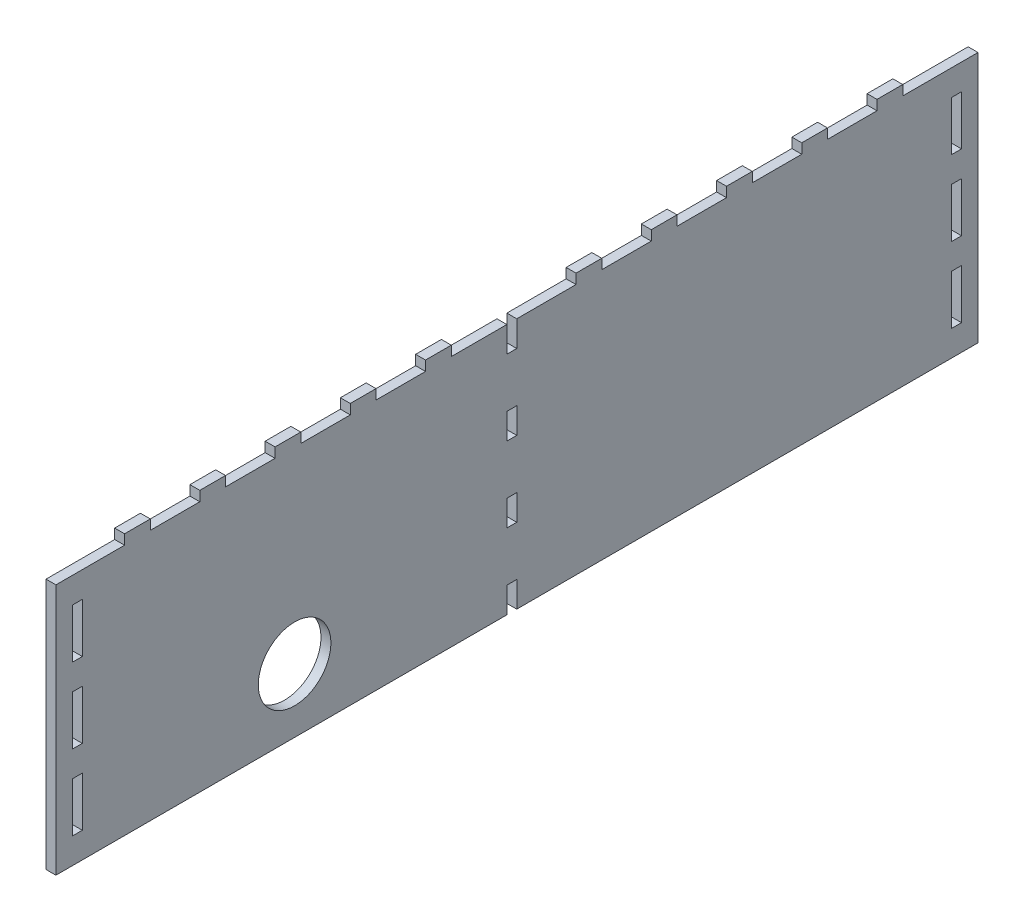
from build123d import *

# Parameters (mm, degrees)
SKETCH1_W               = 279.4
SKETCH1_H               = 76.2
BOSS_EXTRUDE1_DEPTH     = 3
SKETCH3_W               = 3
SKETCH3_H               = 15
CUT_EXTRUDE1_DEPTH      = 145.833352512
LPATTERN1_COUNT         = 3
LPATTERN1_PITCH         = 22.8
MIRROR1_COPY_1_SKETCH_W = 3
MIRROR1_COPY_1_SKETCH_H = 15
MIRROR1_COPY_1_DEPTH    = 145.833352512
MIRROR1_COPY_2_SKETCH_W = 3
MIRROR1_COPY_2_SKETCH_H = 15
MIRROR1_COPY_2_DEPTH    = 145.833352512
SKETCH6_W               = 3
SKETCH6_H               = 7.8
CUT_EXTRUDE2_DEPTH      = 145.833352512
LPATTERN2_COUNT         = 4
LPATTERN2_PITCH         = 22.8
SKETCH8_W               = 3
SKETCH8_H               = 7.8
BOSS_EXTRUDE2_DEPTH     = 3
LPATTERN4_COUNT         = 11
LPATTERN4_PITCH         = 22.8
SKETCH9_R               = 11
CUT_EXTRUDE3_DEPTH      = 146.651295909


with BuildPart() as part:
    # Sketch1 → Boss-Extrude1 (new body)
    with BuildSketch(Plane(origin=(0, 0, 0), x_dir=(0, 0, -1), z_dir=(1, 0, 0))):
        Rectangle(SKETCH1_W, SKETCH1_H)
    extrude(amount=-BOSS_EXTRUDE1_DEPTH)

    # Sketch3 → Cut-Extrude1 (cut, through all)
    with BuildSketch(Plane.ZY.offset(3)):
        with Locations((133.2, 22.8)):
            Rectangle(SKETCH3_W, SKETCH3_H)
    cut_extrude1 = extrude(amount=-CUT_EXTRUDE1_DEPTH, mode=Mode.SUBTRACT)

    # LPattern1: Cut-Extrude1 ×3
    with Locations(*[(0, -i * LPATTERN1_PITCH, 0) for i in range(1, LPATTERN1_COUNT)]):
        add(cut_extrude1, mode=Mode.SUBTRACT)

    # Mirror1: Cut-Extrude1 across plane
    add(cut_extrude1.mirror(Plane.XY), mode=Mode.SUBTRACT)

    # Mirror1 copy 1 sketch → Mirror1 copy 1 (cut, through all)
    with BuildSketch(Plane(origin=(-3, -22.8, 0), x_dir=(0, 0, -1), z_dir=(-1, 0, 0))):
        with Locations((133.2, -22.8)):
            Rectangle(MIRROR1_COPY_1_SKETCH_W, MIRROR1_COPY_1_SKETCH_H)
    extrude(amount=-MIRROR1_COPY_1_DEPTH, mode=Mode.SUBTRACT)

    # Mirror1 copy 2 sketch → Mirror1 copy 2 (cut, through all)
    with BuildSketch(Plane(origin=(-3, -45.6, 0), x_dir=(0, 0, -1), z_dir=(-1, 0, 0))):
        with Locations((133.2, -22.8)):
            Rectangle(MIRROR1_COPY_2_SKETCH_W, MIRROR1_COPY_2_SKETCH_H)
    extrude(amount=-MIRROR1_COPY_2_DEPTH, mode=Mode.SUBTRACT)

    # Sketch6 → Cut-Extrude2 (cut, through all)
    with BuildSketch(Plane.ZY.offset(3)):
        with Locations((1.56, 34.2)):
            Rectangle(SKETCH6_W, SKETCH6_H)
    cut_extrude2 = extrude(amount=-CUT_EXTRUDE2_DEPTH, mode=Mode.SUBTRACT)

    # LPattern2: Cut-Extrude2 ×4
    with Locations(*[(0, -i * LPATTERN2_PITCH, 0) for i in range(1, LPATTERN2_COUNT)]):
        add(cut_extrude2, mode=Mode.SUBTRACT)

    # Sketch8 → Boss-Extrude2 (add)
    with BuildSketch(Plane(origin=(0, 38.1, 0), x_dir=(1, 0, 0), z_dir=(0, 1, 0))):
        with Locations((-1.5, 113)):
            Rectangle(SKETCH8_W, SKETCH8_H)
    boss_extrude2 = extrude(amount=BOSS_EXTRUDE2_DEPTH)

    # LPattern4: Boss-Extrude2 ×11, 1 skipped
    with Locations(*[(0, 0, i * LPATTERN4_PITCH) for i in range(1, LPATTERN4_COUNT) if i not in (5,)]):
        add(boss_extrude2)

    # Sketch9 → Cut-Extrude3 (cut, through all)
    with BuildSketch(Plane.ZY.offset(3)):
        with Locations((67.38, -18.8)):
            Circle(SKETCH9_R)
    extrude(amount=-CUT_EXTRUDE3_DEPTH, mode=Mode.SUBTRACT)


solid = part.part
